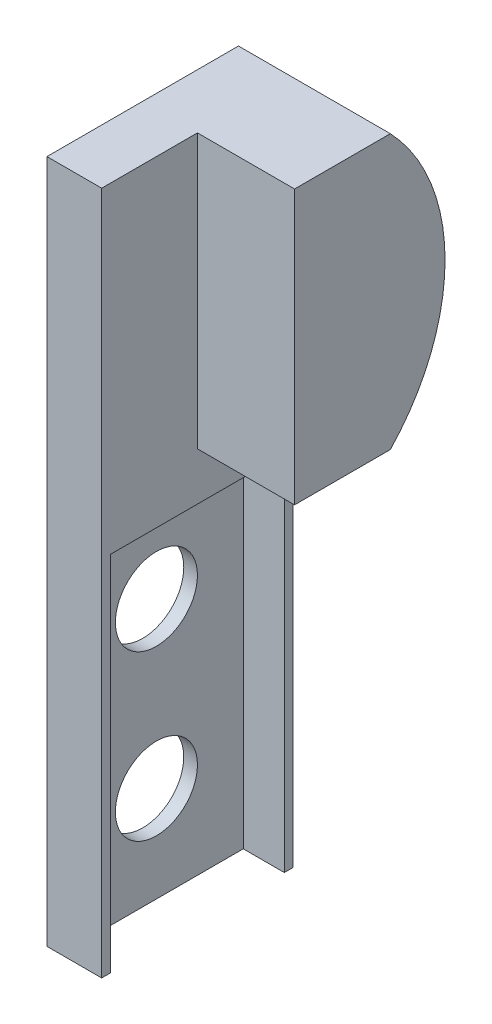
from build123d import *

# Parameters (mm, degrees)
CROQUIS1_W              = 14
CROQUIS1_H              = 50
SALIENTE_EXTRUIR1_DEPTH = 4
CROQUIS2_W              = 3
CROQUIS2_H              = 12.7
CORTAR_EXTRUIR1_DEPTH   = 26.5
SALIENTE_EXTRUIR2_DEPTH = 7.1
CORTAR_EXTRUIR2_REACH   = 54.896
CROQUIS4_R              = 3


with BuildPart() as part:
    # Croquis1 → Saliente-Extruir1 (new body)
    with BuildSketch(Plane(origin=(0, 0, 0), x_dir=(0, 0, -1), z_dir=(1, 0, 0))):
        with Locations((-7, -25)):
            Rectangle(CROQUIS1_W, CROQUIS1_H)
    extrude(amount=SALIENTE_EXTRUIR1_DEPTH)

    # Croquis2 → Cortar-Extruir1 (cut)
    with BuildSketch(Plane.XZ.offset(50)):
        with Locations((2.5, 7)):
            Rectangle(CROQUIS2_W, CROQUIS2_H)
    extrude(amount=-CORTAR_EXTRUIR1_DEPTH, mode=Mode.SUBTRACT)

    # Croquis3 → Saliente-Extruir2 (add)
    with BuildSketch(Plane(origin=(4, 0, 0), x_dir=(0, 0, -1), z_dir=(1, 0, 0))):
        with BuildLine():
            ThreePointArc((0, -20), (4, -10), (0, 0))
            Line((0, 0), (0, -10))
            Line((0, -10), (0, -20))
        make_face()
        Polygon((0, 0), (-7, 0), (-7, -20), (0, -20), (0, -10), align=None)
    extrude(amount=SALIENTE_EXTRUIR2_DEPTH)

    # Croquis4 → Cortar-Extruir2 (cut, up to next)
    with BuildSketch(Plane(origin=(1, 0, 0), x_dir=(0, 0, -1), z_dir=(1, 0, 0)), mode=Mode.PRIVATE) as cortar_extruir2_sk1:
        with Locations((-7, -31)):
            Circle(CROQUIS4_R)
    cortar_extruir2_tool1 = extrude(cortar_extruir2_sk1.sketch, amount=-CORTAR_EXTRUIR2_REACH, mode=Mode.PRIVATE) & part.part
    # Croquis4 → Cortar-Extruir2 (cut, up to next)
    with BuildSketch(Plane(origin=(1, 0, 0), x_dir=(0, 0, -1), z_dir=(1, 0, 0)), mode=Mode.PRIVATE) as cortar_extruir2_sk2:
        with Locations((-7, -43)):
            Circle(CROQUIS4_R)
    cortar_extruir2_tool2 = extrude(cortar_extruir2_sk2.sketch, amount=-CORTAR_EXTRUIR2_REACH, mode=Mode.PRIVATE) & part.part
    add(cortar_extruir2_tool1.solids().sort_by_distance((1, -31, 7))[0], mode=Mode.SUBTRACT)
    add(cortar_extruir2_tool2.solids().sort_by_distance((1, -43, 7))[0], mode=Mode.SUBTRACT)


solid = part.part
